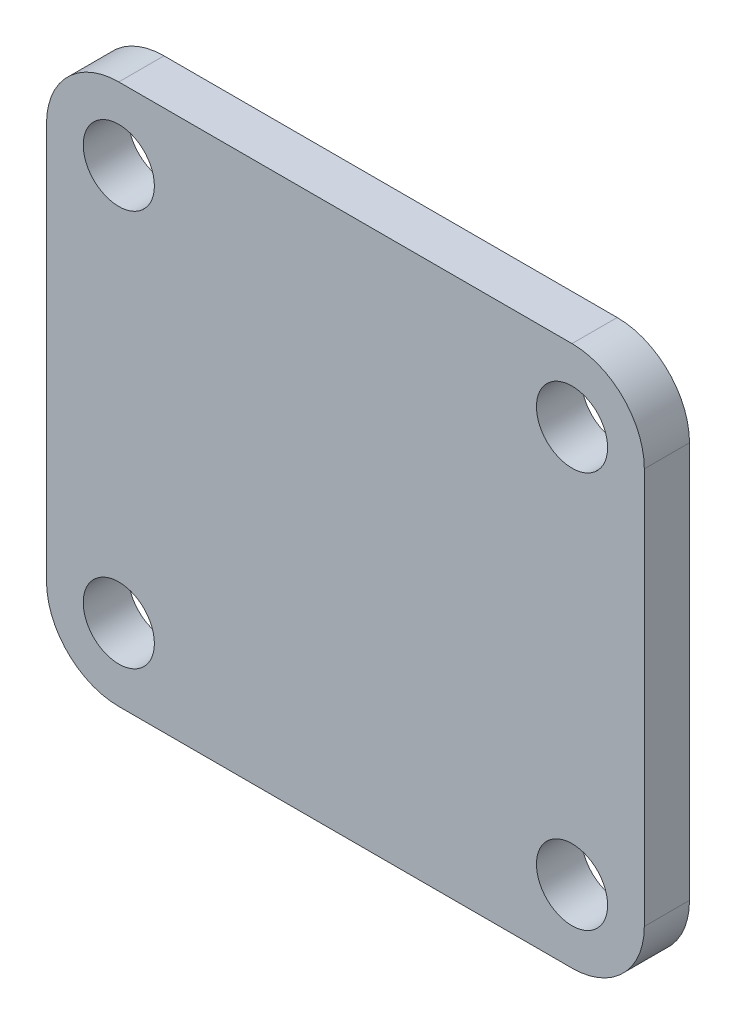
from build123d import *

# Parameters (mm, degrees)
BOSS_EXTRUDE1_DEPTH = 1.5875
SKETCH2_R           = 1.25
CUT_EXTRUDE1_DEPTH  = 15.248514177


with BuildPart() as part:
    # Sketch1 → Boss-Extrude1 (new body)
    with BuildSketch(Plane.XY):
        with BuildLine():
            Line((7.96, -9.5), (-7.96, -9.5))
            ThreePointArc((-7.96, -9.5), (-9.756051224, -8.756051224), (-10.5, -6.96))
            Line((-10.5, -6.96), (-10.5, 6.96))
            ThreePointArc((-10.5, 6.96), (-9.756051224, 8.756051224), (-7.96, 9.5))
            Line((-7.96, 9.5), (7.96, 9.5))
            ThreePointArc((7.96, 9.5), (9.756051224, 8.756051224), (10.5, 6.96))
            Line((10.5, 6.96), (10.5, -6.96))
            ThreePointArc((10.5, -6.96), (9.756051224, -8.756051224), (7.96, -9.5))
        make_face()
    extrude(amount=BOSS_EXTRUDE1_DEPTH)

    # Sketch2 → Cut-Extrude1 (cut, through all)
    with BuildSketch(Plane.XY.offset(1.5875)):
        with Locations((-7.96, 6.96)):
            Circle(SKETCH2_R)
        with Locations((7.96, 6.96)):
            Circle(SKETCH2_R)
        with Locations((7.96, -6.96)):
            Circle(SKETCH2_R)
        with Locations((-7.96, -6.96)):
            Circle(SKETCH2_R)
    extrude(amount=-CUT_EXTRUDE1_DEPTH, mode=Mode.SUBTRACT)


solid = part.part
